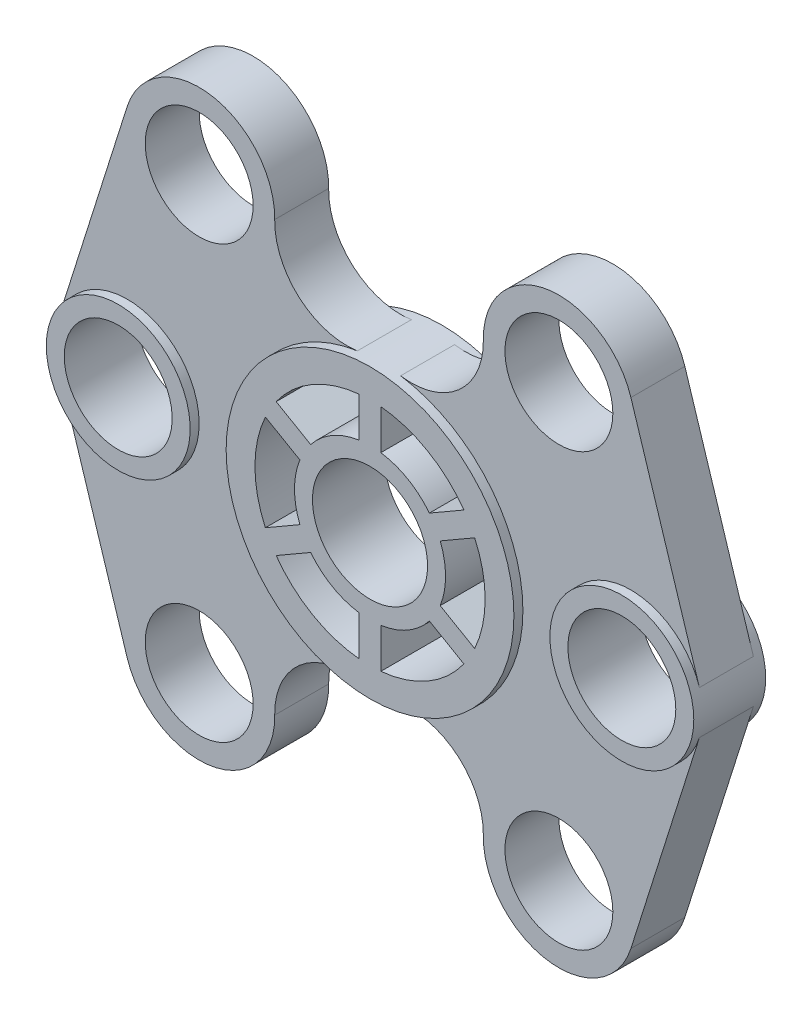
from build123d import *

# Parameters (mm, degrees)
SKETCH1_R             = 20
SKETCH1_R_2           = 15
BOSS_EXTRUDE2_DEPTH   = 10
SKETCH1_R_3           = 40
SKETCH1_R_4           = 16
BOSS_EXTRUDE2_2_DEPTH = 10
BOSS_EXTRUDE2_3_DEPTH = 10
SKETCH1_4_R           = 15
BOSS_EXTRUDE3_DEPTH   = 7.5


with BuildPart() as part:
    # Sketch1 → Boss-Extrude2 (new, symmetric)
    with BuildSketch(Plane.XY):
        with Locations((70, 0)):
            Circle(SKETCH1_R)
        with Locations((70, 0)):
            Circle(SKETCH1_R_2, mode=Mode.SUBTRACT)
    extrude(amount=BOSS_EXTRUDE2_DEPTH, both=True)



with BuildPart() as body_2:
    # Sketch1 → Boss-Extrude2 2 (new, symmetric)
    with BuildSketch(Plane.XY):
        Circle(SKETCH1_R_3)
        with BuildLine():
            ThreePointArc((-16.5, -12.990381057), (-10.5, -18.186533479), (-3, -20.784609691))
            Line((-3, -20.784609691), (-3, -31.859064644))
            ThreePointArc((-3, -31.859064644), (-16, -27.712812921), (-26.090759323, -18.527608533))
            Line((-26.090759323, -18.527608533), (-16.5, -12.990381057))
        make_face(mode=Mode.SUBTRACT)
        with BuildLine():
            Line((3, -31.859064644), (3, -20.784609691))
            ThreePointArc((3, -20.784609691), (10.5, -18.186533479), (16.5, -12.990381057))
            Line((16.5, -12.990381057), (26.090759323, -18.527608533))
            ThreePointArc((26.090759323, -18.527608533), (16, -27.712812921), (3, -31.859064644))
        make_face(mode=Mode.SUBTRACT)
        Circle(SKETCH1_R_4, mode=Mode.SUBTRACT)
        with BuildLine():
            ThreePointArc((19.5, -7.794228634), (21, 0), (19.5, 7.794228634))
            Line((19.5, 7.794228634), (29.090759323, 13.331456111))
            ThreePointArc((29.090759323, 13.331456111), (32, 0), (29.090759323, -13.331456111))
            Line((29.090759323, -13.331456111), (19.5, -7.794228634))
        make_face(mode=Mode.SUBTRACT)
        with BuildLine():
            ThreePointArc((-19.5, 7.794228634), (-21, 0), (-19.5, -7.794228634))
            Line((-19.5, -7.794228634), (-29.090759323, -13.331456111))
            ThreePointArc((-29.090759323, -13.331456111), (-32, 0), (-29.090759323, 13.331456111))
            Line((-29.090759323, 13.331456111), (-19.5, 7.794228634))
        make_face(mode=Mode.SUBTRACT)
        with BuildLine():
            ThreePointArc((-3, 20.784609691), (-10.5, 18.186533479), (-16.5, 12.990381057))
            Line((-16.5, 12.990381057), (-26.090759323, 18.527608533))
            ThreePointArc((-26.090759323, 18.527608533), (-16, 27.712812921), (-3, 31.859064644))
            Line((-3, 31.859064644), (-3, 20.784609691))
        make_face(mode=Mode.SUBTRACT)
        with BuildLine():
            ThreePointArc((16.5, 12.990381057), (10.5, 18.186533479), (3, 20.784609691))
            Line((3, 20.784609691), (3, 31.859064644))
            ThreePointArc((3, 31.859064644), (16, 27.712812921), (26.090759323, 18.527608533))
            Line((26.090759323, 18.527608533), (16.5, 12.990381057))
        make_face(mode=Mode.SUBTRACT)
    extrude(amount=BOSS_EXTRUDE2_2_DEPTH, both=True)


with BuildPart() as body_3:
    # Sketch1 → Boss-Extrude2 3 (new, symmetric)
    with BuildSketch(Plane.XY):
        with Locations((-70, 0)):
            Circle(SKETCH1_R)
        with Locations((-70, 0)):
            Circle(SKETCH1_R_2, mode=Mode.SUBTRACT)
    extrude(amount=BOSS_EXTRUDE2_3_DEPTH, both=True)


with BuildPart() as part_1:
    add(part.part)

    add(body_2.part)  # Boss-Extrude3 merges body 2

    add(body_3.part)  # Boss-Extrude3 merges body 3
    # Sketch1<4> → Boss-Extrude3 (add, symmetric)
    # profile 1 of 2: a face of its own
    with BuildSketch(Plane.XY):
        with BuildLine():
            Line((89.071294105, 6.023764702), (70.02485881, 66.324952937))
            ThreePointArc((70.02485881, 66.324952937), (46.6282273, 80.727545655), (29.002885891, 59.651863383))
            ThreePointArc((29.002885891, 59.651863383), (22.168588856, 44.262528341), (6.003756239, 39.546869801))
            ThreePointArc((6.003756239, 39.546869801), (40, 0), (6.003756239, -39.546869801))
            ThreePointArc((6.003756239, -39.546869801), (22.168588856, -44.262528341), (29.002885891, -59.651863383))
            ThreePointArc((29.002885891, -59.651863383), (46.6282273, -80.727545655), (70.02485881, -66.324952937))
            Line((70.02485881, -66.324952937), (89.071294105, -6.023764702))
            ThreePointArc((89.071294105, -6.023764702), (50, 0), (89.071294105, 6.023764702))
        make_face()
        with Locations((50, -60)):
            Circle(SKETCH1_4_R, mode=Mode.SUBTRACT)
        with Locations((50, 60)):
            Circle(SKETCH1_4_R, mode=Mode.SUBTRACT)
    # profile 2 of 2: a face of its own
    with BuildSketch(Plane.XY):
        with BuildLine():
            ThreePointArc((-6.003756239, -39.546869801), (-40, 0), (-6.003756239, 39.546869801))
            ThreePointArc((-6.003756239, 39.546869801), (-22.168588856, 44.262528341), (-29.002885891, 59.651863383))
            ThreePointArc((-29.002885891, 59.651863383), (-46.6282273, 80.727545655), (-70.02485881, 66.324952937))
            Line((-70.02485881, 66.324952937), (-89.071294105, 6.023764702))
            ThreePointArc((-89.071294105, 6.023764702), (-50, 0), (-89.071294105, -6.023764702))
            Line((-89.071294105, -6.023764702), (-70.02485881, -66.324952937))
            ThreePointArc((-70.02485881, -66.324952937), (-46.6282273, -80.727545655), (-29.002885891, -59.651863383))
            ThreePointArc((-29.002885891, -59.651863383), (-22.168588856, -44.262528341), (-6.003756239, -39.546869801))
        make_face()
        with Locations((-50, -60)):
            Circle(SKETCH1_4_R, mode=Mode.SUBTRACT)
        with Locations((-50, 60)):
            Circle(SKETCH1_4_R, mode=Mode.SUBTRACT)
    extrude(amount=BOSS_EXTRUDE3_DEPTH, both=True)


solid = part_1.part
